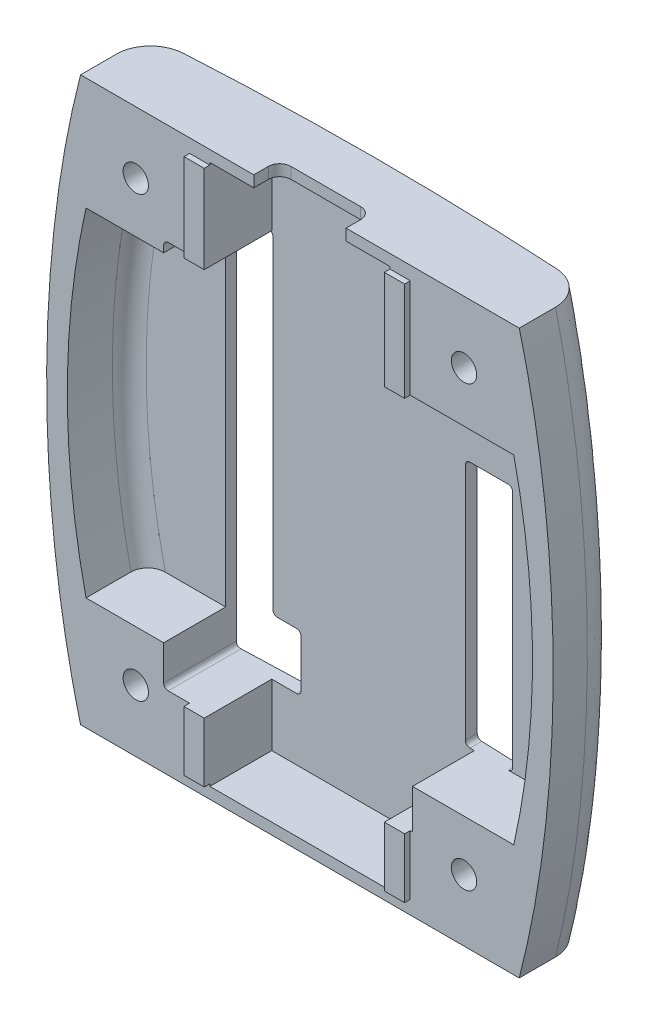
from build123d import *

# Parameters (mm, degrees)
SKETCH1_R               = 1.125
BOSS_EXTRUDE1_DEPTH     = 6.7
CUT_EXTRUDE3_DEPTH      = 5.5
CUT_EXTRUDE5_DEPTH      = 6.5
SKETCH15_R              = 2.1
CUT_EXTRUDE10_DEPTH     = 2.5
SKETCH10_W              = 53.517702925
SKETCH10_H              = 1.5
CUT_EXTRUDE7_DEPTH      = 55
CUT_EXTRUDE9_DEPTH      = 42.5
CUT_EXTRUDE8_DEPTH      = 35.294897738
CUT_EXTRUDE8_DEPTH_BACK = 35.294897738
SKETCH11_R              = 500
SKETCH11_R_2            = 290
FILLET1_R               = 1.5
FILLET2_R               = 3
SKETCH14_W              = 2
SKETCH14_H              = 8
SKETCH14_H_2            = 9
SKETCH14_H_3            = 5.5
BOSS_EXTRUDE2_DEPTH     = 6
CUT_EXTRUDE11_DEPTH     = 35.294898253


with BuildPart() as part:
    # Sketch1 → Boss-Extrude1 (new body)
    with BuildSketch(Plane(origin=(0, 0, 0), x_dir=(0, -1, 0), z_dir=(0, 0, 1))):
        with BuildLine():
            Line((-26.5, -19.079946934), (-26.5, 19.079946934))
            add(Edge.make_bspline(
                [(26.5, 19.079946934), (0, 26.533092663), (-26.5, 19.079946934)],
                knots=[1.012195761, 1.012195761, 1.012195761, 2.129396892, 2.129396892, 2.129396892], degree=2, weights=[1, 0.847997642, 1]))
            Line((26.5, 19.079946934), (26.5, -19.079946934))
            add(Edge.make_bspline(
                [(-26.5, -19.079946934), (0, -26.533092663), (26.5, -19.079946934)],
                knots=[4.153788415, 4.153788415, 4.153788415, 5.270989546, 5.270989546, 5.270989546], degree=2, weights=[1, 0.847997642, 1]))
        make_face()
        with Locations((-19.5, 14.579946934)):
            Circle(SKETCH1_R, mode=Mode.SUBTRACT)
        with Locations((19.5, 14.579946934)):
            Circle(SKETCH1_R, mode=Mode.SUBTRACT)
        with Locations((19.5, -14.579946934)):
            Circle(SKETCH1_R, mode=Mode.SUBTRACT)
        with Locations((-19.5, -14.579946934)):
            Circle(SKETCH1_R, mode=Mode.SUBTRACT)
    extrude(amount=BOSS_EXTRUDE1_DEPTH)

    # Sketch4 → Cut-Extrude3 (cut)
    with BuildSketch(Plane.XY.offset(6.7)):
        with BuildLine():
            Line((18.999946934, 15), (9.999946934, 15))
            Line((9.999946934, 15), (9.999946934, 24))
            Line((9.999946934, 24), (-10.000053066, 24))
            Line((-10.000053066, 24), (-10.000053066, 15))
            Line((-10.000053066, 15), (-19.000053066, 15))
            ThreePointArc((-19.000053066, 15), (-20.662563586, 0), (-19.000053066, -15))
            Line((-19.000053066, -15), (-10.000053066, -15))
            Line((-10.000053066, -15), (-10.000053066, -24))
            Line((-10.000053066, -24), (9.999946934, -24))
            Line((9.999946934, -24), (9.999946934, -15))
            Line((9.999946934, -15), (18.999946934, -15))
            ThreePointArc((18.999946934, -15), (20.662457454, 0), (18.999946934, 15))
        make_face()
    extrude(amount=-CUT_EXTRUDE3_DEPTH, mode=Mode.SUBTRACT)

    # Sketch8 → Cut-Extrude5 (cut)
    with BuildSketch(Plane(origin=(0, 26.5, 0), x_dir=(1, 0, 0), z_dir=(0, 1, 0))):
        with BuildLine():
            Line((3.100053066, -4.4), (-3.099946934, -4.4))
            ThreePointArc((-3.099946934, -4.4), (-3.807053715, -4.692893219), (-4.099946934, -5.4))
            Line((-4.099946934, -5.4), (-4.099946934, -8))
            Line((-4.099946934, -8), (4.100053066, -8))
            Line((4.100053066, -8), (4.100053066, -5.4))
            ThreePointArc((4.100053066, -5.4), (3.807159847, -4.692893219), (3.100053066, -4.4))
        make_face()
    extrude(amount=-CUT_EXTRUDE5_DEPTH, mode=Mode.SUBTRACT)

    # Sketch15 → Cut-Extrude10 (cut)
    with BuildSketch(Plane(origin=(0, 0, 0), x_dir=(-1, 0, 0), z_dir=(0, 0, -1))):
        with Locations((14.579946934, -19.5)):
            Circle(SKETCH15_R)
        with Locations((-14.579946934, -19.5)):
            Circle(SKETCH15_R)
        with Locations((-14.579946934, 19.5)):
            Circle(SKETCH15_R)
        with Locations((14.579946934, 19.5)):
            Circle(SKETCH15_R)
    extrude(amount=-CUT_EXTRUDE10_DEPTH, mode=Mode.SUBTRACT)

    # Sketch10 → Cut-Extrude7 (cut)
    with BuildSketch(Plane.XY.offset(6.7)):
        with Locations((-1.09539158, -25.75)):
            Rectangle(SKETCH10_W, SKETCH10_H)
        with Locations((-1.09539158, 25.75)):
            Rectangle(SKETCH10_W, SKETCH10_H)
    extrude(amount=-CUT_EXTRUDE7_DEPTH, mode=Mode.SUBTRACT)

    # Sketch12 → Cut-Extrude9 (cut)
    with BuildSketch(Plane(origin=(0, 0, 0), x_dir=(-1, 0, 0), z_dir=(0, 0, -1))):
        with BuildLine():
            Line((7.500053066, -13.5), (5.800053066, -13.5))
            ThreePointArc((5.800053066, -13.5), (5.517210354, -13.617157288), (5.400053066, -13.9))
            Line((5.400053066, -13.9), (5.400053066, -18.1))
            ThreePointArc((5.400053066, -18.1), (5.517210354, -18.382842712), (5.800053066, -18.5))
            Line((5.800053066, -18.5), (11.700053066, -18.5))
            ThreePointArc((11.700053066, -18.5), (11.982895779, -18.382842712), (12.100053066, -18.1))
            Line((12.100053066, -18.1), (12.100053066, 15.6))
            ThreePointArc((12.100053066, 15.6), (11.982895779, 15.882842712), (11.700053066, 16))
            Line((11.700053066, 16), (8.300053066, 16))
            ThreePointArc((8.300053066, 16), (8.017210354, 15.882842712), (7.900053066, 15.6))
            Line((7.900053066, 15.6), (7.900053066, 7))
            Line((7.900053066, 7), (7.900053066, -13.1))
            ThreePointArc((7.900053066, -13.1), (7.782895779, -13.382842712), (7.500053066, -13.5))
        make_face()
        with BuildLine():
            Line((-9.599946934, -15), (-12.999946934, -15))
            ThreePointArc((-12.999946934, -15), (-13.282789646, -14.882842712), (-13.399946934, -14.6))
            Line((-13.399946934, -14.6), (-13.399946934, 6.6))
            ThreePointArc((-13.399946934, 6.6), (-13.282789646, 6.882842712), (-12.999946934, 7))
            Line((-12.999946934, 7), (-9.599946934, 7))
            ThreePointArc((-9.599946934, 7), (-9.317104221, 6.882842712), (-9.199946934, 6.6))
            Line((-9.199946934, 6.6), (-9.199946934, -14.6))
            ThreePointArc((-9.199946934, -14.6), (-9.317104221, -14.882842712), (-9.599946934, -15))
        make_face()
    extrude(amount=-CUT_EXTRUDE9_DEPTH, mode=Mode.SUBTRACT)

    # Sketch11 → Cut-Extrude8 (cut, two sides: drawn at the far end of the back side and taken through both)
    with BuildSketch(Plane(origin=(0, 0, 0), x_dir=(1, 0, 0), z_dir=(0, 1, 0)).offset(-CUT_EXTRUDE8_DEPTH_BACK)):
        with Locations((0, -290)):
            Circle(SKETCH11_R)
        with Locations((0, -290)):
            Circle(SKETCH11_R_2, mode=Mode.SUBTRACT)
    extrude(amount=CUT_EXTRUDE8_DEPTH + CUT_EXTRUDE8_DEPTH_BACK, mode=Mode.SUBTRACT)

    # Fillet1
    fillet1_edges = [part.edges().sort_by_distance(p)[0] for p in [
        (-20.662563586, 0, 1.2),
        (20.662457454, 0, 1.2),
    ]]
    fillet(fillet1_edges, radius=FILLET1_R)

    # Fillet2
    fillet2_edges = [part.edges().sort_by_distance(p)[0] for p in [
        (-21.774320135, -12.596096379, 0.8186054),
        (21.7743201, 12.596096677, 0.818605397),
    ]]
    fillet(fillet2_edges, radius=FILLET2_R)

    # Sketch14 → Boss-Extrude2 (add)
    with BuildSketch(Plane.XY.offset(1.2)):
        with Locations((-9.000053066, 20)):
            Rectangle(SKETCH14_W, SKETCH14_H)
        with Locations((8.999946934, 19.5)):
            Rectangle(SKETCH14_W, SKETCH14_H_2)
        with Locations((8.999946934, -21.25)):
            Rectangle(SKETCH14_W, SKETCH14_H_3)
        with Locations((-9.000053066, -21.25)):
            Rectangle(SKETCH14_W, SKETCH14_H_3)
    extrude(amount=BOSS_EXTRUDE2_DEPTH)

    # Sketch16 → Cut-Extrude11 (cut, through all)
    with BuildSketch(Plane.XY.offset(6.7)):
        Polygon((7.999946934, 24), (9.999946934, 24), (9.999946934, 15), (9.799946934, 15), (9.799946934, 23.8), (7.999946934, 23.8), align=None)
        Polygon((-8.000053066, 24), (-10.000053066, 24), (-10.000053066, 16), (-9.796123008, 16), (-9.796123008, 23.8), (-8.000053066, 23.8), align=None)
        Polygon((9.999946934, -18.5), (9.999946934, -24), (7.999946934, -24), (7.999946934, -23.8), (9.799946934, -23.8), (9.799946934, -18.5), align=None)
        Polygon((-10.000053066, -18.5), (-10.000053066, -24), (-8.000053066, -24), (-8.000053066, -23.8), (-9.800053066, -23.8), (-9.800053066, -18.5), align=None)
    extrude(amount=CUT_EXTRUDE11_DEPTH, mode=Mode.SUBTRACT)


solid = part.part
